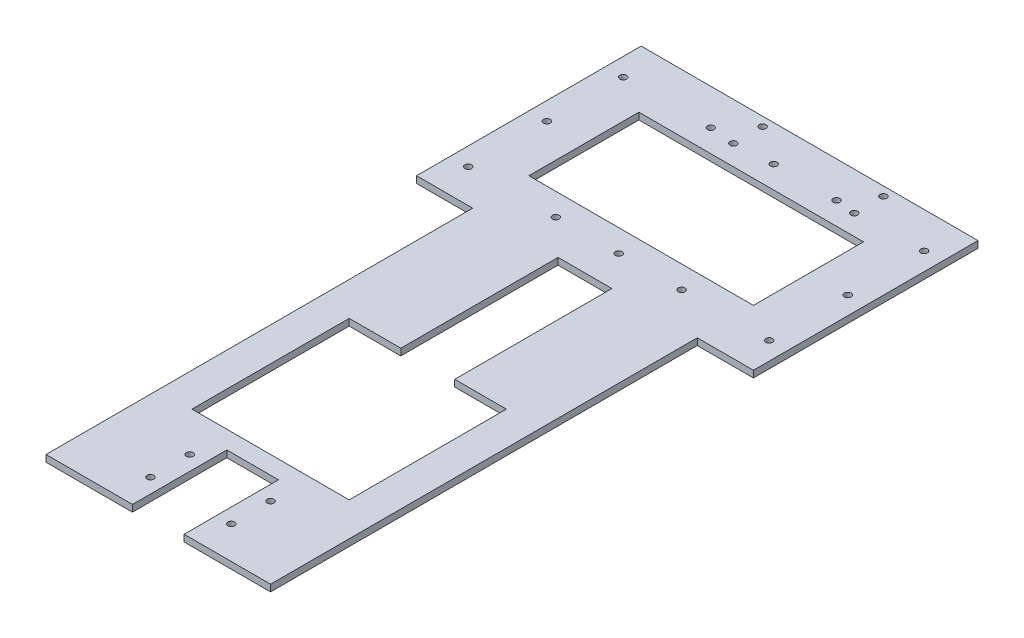
from build123d import *

# Parameters (mm, degrees)
SKETCH_1_R      = 1.5
SKETCH_1_W      = 100
SKETCH_1_H      = 49
EXTRUDE_1_DEPTH = 3


with BuildPart() as part:
    # ｽｹｯﾁ1 → ﾎﾞｽ - 押し出し1 (new body)
    with BuildSketch(Plane.XZ):
        Polygon((61.5, -42), (38.5, -42), (38.5, 0), (0, 0), (0, -190), (-25, -190), (-25, -290), (125, -290), (125, -190), (100, -190), (100, 0), (61.5, 0), align=None)
        with Locations(Location((33.1, -286, 0), (0, 0, 90))):
            Circle(SKETCH_1_R, mode=Mode.SUBTRACT)
        with Locations(Location((86.9, -286, 0), (0, 0, 90))):
            Circle(SKETCH_1_R, mode=Mode.SUBTRACT)
        with Locations(Location((-17, -274, 0), (0, 0, 90))):
            Circle(SKETCH_1_R, mode=Mode.SUBTRACT)
        with Locations(Location((50, -274, 0), (0, 0, 90))):
            Circle(SKETCH_1_R, mode=Mode.SUBTRACT)
        with Locations(Location((117, -274, 0), (0, 0, 90))):
            Circle(SKETCH_1_R, mode=Mode.SUBTRACT)
        with Locations(Location((78, -205, 0), (0, 0, 90))):
            Circle(SKETCH_1_R, mode=Mode.SUBTRACT)
        with Locations(Location((22, -205, 0), (0, 0, 90))):
            Circle(SKETCH_1_R, mode=Mode.SUBTRACT)
        with Locations(Location((68, -14.5, 0), (0, 0, 90))):
            Circle(SKETCH_1_R, mode=Mode.SUBTRACT)
        with Locations(Location((32, -32, 0), (0, 0, 90))):
            Circle(SKETCH_1_R, mode=Mode.SUBTRACT)
        with Locations(Location((32, -14.5, 0), (0, 0, 90))):
            Circle(SKETCH_1_R, mode=Mode.SUBTRACT)
        with Locations(Location((68, -32, 0), (0, 0, 90))):
            Circle(SKETCH_1_R, mode=Mode.SUBTRACT)
        with Locations(Location((-17, -205, 0), (0, 0, 90))):
            Circle(SKETCH_1_R, mode=Mode.SUBTRACT)
        with Locations(Location((50, -205, 0), (0, 0, 90))):
            Circle(SKETCH_1_R, mode=Mode.SUBTRACT)
        with Locations(Location((117, -205, 0), (0, 0, 90))):
            Circle(SKETCH_1_R, mode=Mode.SUBTRACT)
        with Locations(Location((78, -274, 0), (0, 0, 90))):
            Circle(SKETCH_1_R, mode=Mode.SUBTRACT)
        with Locations(Location((22, -274, 0), (0, 0, 90))):
            Circle(SKETCH_1_R, mode=Mode.SUBTRACT)
        with Locations(Location((86.9, -273, 0), (0, 0, 90))):
            Circle(SKETCH_1_R, mode=Mode.SUBTRACT)
        with Locations(Location((33.1, -273, 0), (0, 0, 90))):
            Circle(SKETCH_1_R, mode=Mode.SUBTRACT)
        with Locations(Location((117, -240, 0), (0, 0, 90))):
            Circle(SKETCH_1_R, mode=Mode.SUBTRACT)
        with Locations(Location((-17, -240, 0), (0, 0, 90))):
            Circle(SKETCH_1_R, mode=Mode.SUBTRACT)
        with Locations((50, -239.5)):
            Rectangle(SKETCH_1_W, SKETCH_1_H, mode=Mode.SUBTRACT)
        Polygon((85, -50), (85, -120), (62, -120), (62, -190), (38, -190), (38, -120), (15, -120), (15, -50), align=None, mode=Mode.SUBTRACT)
    extrude(amount=-EXTRUDE_1_DEPTH)


solid = part.part
